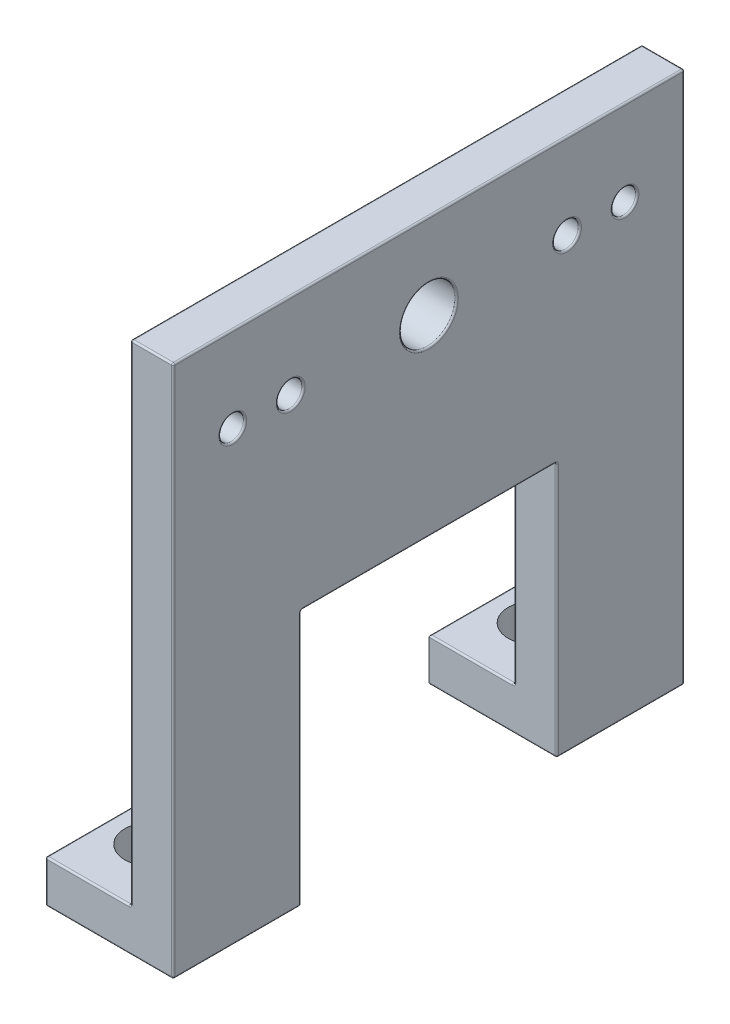
from build123d import *

# Parameters (mm, degrees)
BOSS_EXTRUDE1_DEPTH = 60
SKETCH2_R           = 3.25
SKETCH2_R_2         = 1.435
SKETCH2_R_3         = 1.5
CUT_EXTRUDE1_DEPTH  = 88.949564871
CUT_EXTRUDE2_START  = -15
CUT_EXTRUDE2_DEPTH  = 30
FILLET16_R          = 0.2
SKETCH4_R           = 3.175
CUT_EXTRUDE3_DEPTH  = 85.467839803


with BuildPart() as part:
    # Sketch1 → Boss-Extrude1 (new body)
    with BuildSketch(Plane.XY):
        Polygon((0, 0), (15, 0), (15, 5), (15, 62.531), (10, 62.531), (10, 5), (0, 5), align=None)
    extrude(amount=BOSS_EXTRUDE1_DEPTH)

    # Sketch2 → Cut-Extrude1 (cut, through all)
    with BuildSketch(Plane(origin=(15, 0, 0), x_dir=(0, 0, -1), z_dir=(1, 0, 0))):
        with Locations(Location((-30, 52.531, 0), (0, 0, 90))):
            Circle(SKETCH2_R)
        with Locations(Location((-6.9875, 52.531, 0), (0, 0, 90))):
            Circle(SKETCH2_R_2)
        with Locations(Location((-13.785, 52.531, 0), (0, 0, 90))):
            Circle(SKETCH2_R_3)
        with Locations(Location((-46.215, 52.531, 0), (0, 0, 90))):
            Circle(SKETCH2_R_3)
        with Locations(Location((-53.0125, 52.531, 0), (0, 0, 90))):
            Circle(SKETCH2_R_2)
    extrude(amount=-CUT_EXTRUDE1_DEPTH, mode=Mode.SUBTRACT)

    # Sketch3 → Cut-Extrude2 (cut)
    with BuildSketch(Plane(origin=(0, 0, 0), x_dir=(-1, 0, 0), z_dir=(0, 0, -1)).offset(CUT_EXTRUDE2_START)):
        Polygon((-15, 30), (-10, 30), (-10, 5), (0, 5), (0, 0), (-15, 0), align=None)
    extrude(amount=-CUT_EXTRUDE2_DEPTH, mode=Mode.SUBTRACT)

    # Fillet16
    fillet16_edges = [part.edges().sort_by_distance(p)[0] for p in [
        (0, 2.5, 0),
        (0, 5, 52.5),
        (10, 5, 52.5),
        (10, 62.531, 30),
        (15, 31.2655, 60),
        (15, 62.531, 30),
        (15, 0, 52.5),
        (0, 0, 52.5),
        (12.5, 62.531, 60),
        (10, 33.7655, 60),
        (10, 51.096, 53.0125),
        (5, 5, 60),
        (15, 51.096, 53.0125),
        (10, 51.031, 46.215),
        (15, 51.031, 46.215),
        (10, 51.031, 13.785),
        (15, 51.031, 13.785),
        (10, 51.096, 6.9875),
        (15, 51.096, 6.9875),
        (10, 49.281, 30),
        (15, 49.281, 30),
        (0, 5, 7.5),
        (10, 5, 7.5),
        (0, 2.5, 60),
        (15, 0, 7.5),
        (0, 0, 7.5),
        (7.5, 0, 45),
        (15, 15, 45),
        (12.5, 30, 45),
        (15, 30, 30),
        (10, 17.5, 45),
        (10, 30, 30),
        (5, 5, 45),
        (7.5, 0, 15),
        (5, 5, 15),
        (10, 17.5, 15),
        (12.5, 30, 15),
        (15, 15, 15),
        (5, 5, 0),
        (10, 33.7655, 0),
        (12.5, 62.531, 0),
        (15, 31.2655, 0),
        (7.5, 0, 60),
        (7.5, 0, 0),
    ]]
    fillet(fillet16_edges, radius=FILLET16_R)

    # Sketch4 → Cut-Extrude3 (cut, through all)
    with BuildSketch(Plane(origin=(0, 5, 0), x_dir=(1, 0, 0), z_dir=(0, 1, 0))):
        with Locations(Location((5, -7.5, 0), (0, 0, 270))):
            Circle(SKETCH4_R)
        with Locations(Location((5, -52.5, 0), (0, 0, 270))):
            Circle(SKETCH4_R)
    extrude(amount=-CUT_EXTRUDE3_DEPTH, mode=Mode.SUBTRACT)


solid = part.part
